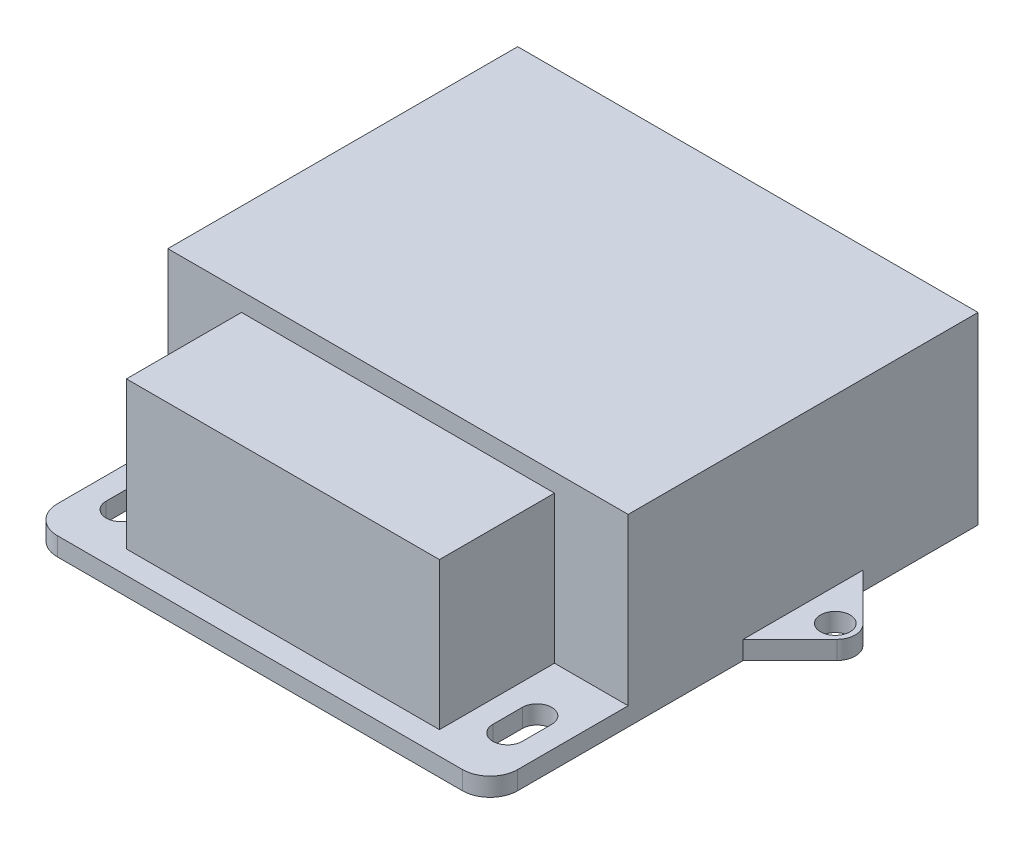
from build123d import *

# Parameters (mm, degrees)
SZKIC2_W                    = 50
SZKIC2_H                    = 53
DODANIE_WYCI_GNI_CIE1_DEPTH = 2
ZAOKR_GLENIE1_R             = 3
SZKIC3_W                    = 50
SZKIC3_H                    = 38
DODANIE_WYCI_GNI_CIE2_DEPTH = 18
SZKIC4_W                    = 34
SZKIC4_H                    = 12.5
DODANIE_WYCI_GNI_CIE3_DEPTH = 16
SZKIC5_R                    = 1.6
DODANIE_WYCI_GNI_CIE4_DEPTH = 2
ZAOKR_GLENIE2_R             = 2


with BuildPart() as part:
    # Szkic2 → Dodanie-wyciągnięcie1 (new body)
    with BuildSketch(Plane(origin=(0, 0, 0), x_dir=(1, 0, 0), z_dir=(0, 1, 0))):
        Rectangle(SZKIC2_W, SZKIC2_H)
        with BuildLine():
            Line((22.6, -17.4), (22.6, -20.6))
            ThreePointArc((22.6, -20.6), (21, -22.2), (19.4, -20.6))
            Line((19.4, -20.6), (19.4, -17.4))
            ThreePointArc((19.4, -17.4), (21, -15.8), (22.6, -17.4))
        make_face(mode=Mode.SUBTRACT)
        with BuildLine():
            Line((-22.6, -17.4), (-22.6, -20.6))
            ThreePointArc((-22.6, -20.6), (-21, -22.2), (-19.4, -20.6))
            Line((-19.4, -20.6), (-19.4, -17.4))
            ThreePointArc((-19.4, -17.4), (-21, -15.8), (-22.6, -17.4))
        make_face(mode=Mode.SUBTRACT)
    extrude(amount=DODANIE_WYCI_GNI_CIE1_DEPTH)

    # Zaokrąglenie1
    zaokr_glenie1_edges = [part.edges().sort_by_distance(p)[0] for p in [
        (25, 1, 26.5),
        (-25, 1, 26.5),
    ]]
    fillet(zaokr_glenie1_edges, radius=ZAOKR_GLENIE1_R)

    # Szkic3 → Dodanie-wyciągnięcie2 (add)
    with BuildSketch(Plane(origin=(0, 2, 0), x_dir=(1, 0, 0), z_dir=(0, 1, 0))):
        with Locations((0, 7.5)):
            Rectangle(SZKIC3_W, SZKIC3_H)
    extrude(amount=DODANIE_WYCI_GNI_CIE2_DEPTH)

    # Szkic4 → Dodanie-wyciągnięcie3 (add)
    with BuildSketch(Plane(origin=(0, 2, 0), x_dir=(1, 0, 0), z_dir=(0, 1, 0))):
        with Locations((0, -17.75)):
            Rectangle(SZKIC4_W, SZKIC4_H)
    extrude(amount=DODANIE_WYCI_GNI_CIE3_DEPTH)

    # Szkic5 → Dodanie-wyciągnięcie4 (add)
    with BuildSketch(Plane(origin=(0, 2, 0), x_dir=(1, 0, 0), z_dir=(0, 1, 0))):
        Polygon((-31.5, 7.5), (-25, 14), (-25, 1), align=None)
        with Locations(Location((-28.5, 7.5, 0), (0, 0, 270))):
            Circle(SZKIC5_R, mode=Mode.SUBTRACT)
    dodanie_wyci_gni_cie4 = extrude(amount=-DODANIE_WYCI_GNI_CIE4_DEPTH)

    # Lustro1: Dodanie-wyciągnięcie4 across plane
    add(dodanie_wyci_gni_cie4.mirror(Plane(origin=(0, 0, 0), x_dir=(0, 0, 1), z_dir=(1, 0, 0))))

    # Zaokrąglenie2
    zaokr_glenie2_edges = [part.edges().sort_by_distance(p)[0] for p in [
        (-31.5, 1, -7.5),
        (31.5, 1, -7.5),
    ]]
    fillet(zaokr_glenie2_edges, radius=ZAOKR_GLENIE2_R)


solid = part.part
